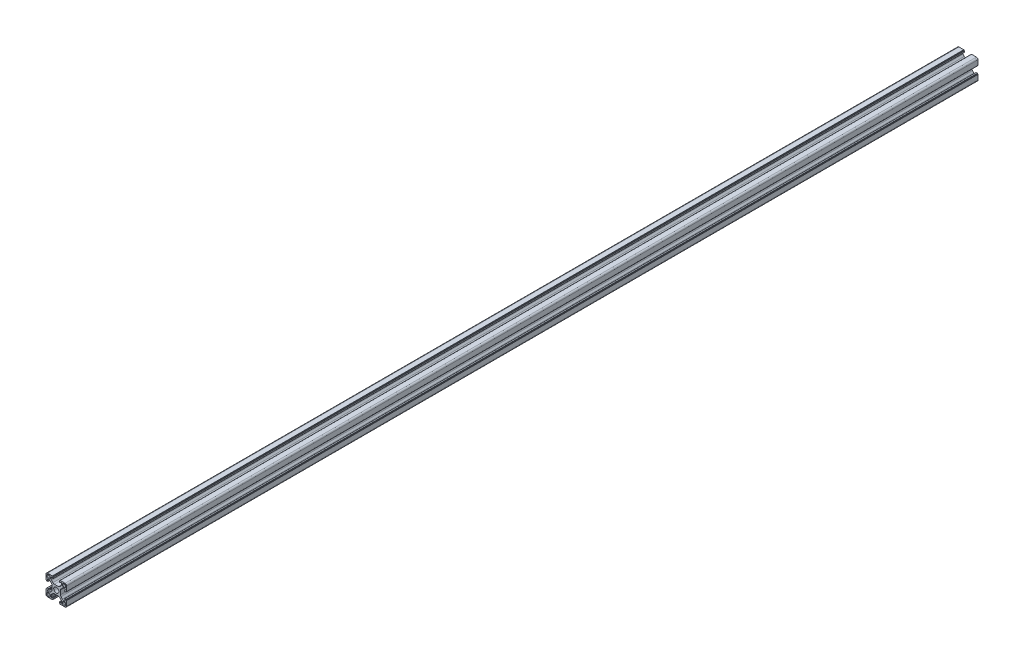
from build123d import *

# Parameters (mm, degrees)
EXTRUDE_1_DEPTH = 885


with BuildPart() as part:
    # Эскиз2 → Бобышка-Вытянуть1 (new body)
    with BuildSketch(Plane.XY):
        with BuildLine():
            Line((0.129852449, 4.683728486), (2.028633118, 4.683728486))
            ThreePointArc((2.028633118, 4.683728486), (2.793999983, 4.835969421), (3.44284668, 5.269514923))
            Line((3.44284668, 5.269514923), (4.744066011, 6.570734254))
            ThreePointArc((4.744066011, 6.570734254), (5.177611514, 7.219580952), (5.329852449, 7.984947817))
            Line((5.329852449, 7.984947817), (5.329852449, 8.883728486))
            ThreePointArc((5.329852449, 8.883728486), (5.183405839, 9.237281876), (4.829852449, 9.383728486))
            Line((4.829852449, 9.383728486), (4.72695923, 9.383728486))
            ThreePointArc((4.72695923, 9.383728486), (4.535617514, 9.345668252), (4.373405839, 9.237281876))
            Line((4.373405839, 9.237281876), (3.893075754, 8.75695179))
            ThreePointArc((3.893075754, 8.75695179), (3.811969916, 8.702758603), (3.716299058, 8.683728486))
            Line((3.716299058, 8.683728486), (3.429852449, 8.683728486))
            ThreePointArc((3.429852449, 8.683728486), (3.253075754, 8.75695179), (3.179852449, 8.933728486))
            Line((3.179852449, 8.933728486), (3.179852449, 10.082799306))
            ThreePointArc((3.179852449, 10.082799306), (3.223786432, 10.188865323), (3.329852449, 10.232799306))
            Line((3.329852449, 10.232799306), (3.829852449, 10.232799306))
            Line((3.829852449, 10.232799306), (3.829852449, 10.533728486))
            ThreePointArc((3.829852449, 10.533728486), (3.873786432, 10.639794503), (3.979852449, 10.683728486))
            Line((3.979852449, 10.683728486), (8.629852449, 10.683728486))
            ThreePointArc((8.629852449, 10.683728486), (9.690512621, 10.244388658), (10.129852449, 9.183728486))
            Line((10.129852449, 9.183728486), (10.129852449, 4.533728486))
            ThreePointArc((10.129852449, 4.533728486), (10.085918466, 4.427662469), (9.979852449, 4.383728486))
            Line((9.979852449, 4.383728486), (9.678923269, 4.383728486))
            Line((9.678923269, 4.383728486), (9.678923269, 3.883728486))
            ThreePointArc((9.678923269, 3.883728486), (9.634989287, 3.777662469), (9.528923269, 3.733728486))
            Line((9.528923269, 3.733728486), (8.379852449, 3.733728486))
            ThreePointArc((8.379852449, 3.733728486), (8.203075754, 3.80695179), (8.129852449, 3.983728486))
            Line((8.129852449, 3.983728486), (8.129852449, 4.270175095))
            ThreePointArc((8.129852449, 4.270175095), (8.148882566, 4.365845953), (8.203075754, 4.44695179))
            Line((8.203075754, 4.44695179), (8.683405839, 4.927281876))
            ThreePointArc((8.683405839, 4.927281876), (8.791792215, 5.089493551), (8.829852449, 5.280835267))
            Line((8.829852449, 5.280835267), (8.829852449, 5.383728486))
            ThreePointArc((8.829852449, 5.383728486), (8.683405839, 5.737281876), (8.329852449, 5.883728486))
            Line((8.329852449, 5.883728486), (7.43107178, 5.883728486))
            ThreePointArc((7.43107178, 5.883728486), (6.665704915, 5.731487551), (6.016858217, 5.297942048))
            Line((6.016858217, 5.297942048), (4.715638886, 3.996722717))
            ThreePointArc((4.715638886, 3.996722717), (4.282093384, 3.34787602), (4.129852449, 2.582509155))
            Line((4.129852449, 2.582509155), (4.129852449, 0.683728486))
            Line((4.129852449, 0.683728486), (4.129852449, -1.215052183))
            ThreePointArc((4.129852449, -1.215052183), (4.282093384, -1.980419048), (4.715638886, -2.629265746))
            Line((4.715638886, -2.629265746), (6.016858217, -3.930485077))
            ThreePointArc((6.016858217, -3.930485077), (6.665704915, -4.364030579), (7.43107178, -4.516271514))
            Line((7.43107178, -4.516271514), (8.329852449, -4.516271514))
            ThreePointArc((8.329852449, -4.516271514), (8.683405839, -4.369824905), (8.829852449, -4.016271514))
            Line((8.829852449, -4.016271514), (8.829852449, -3.913378295))
            ThreePointArc((8.829852449, -3.913378295), (8.791792215, -3.722036579), (8.683405839, -3.559824905))
            Line((8.683405839, -3.559824905), (8.203075754, -3.079494819))
            ThreePointArc((8.203075754, -3.079494819), (8.148882566, -2.998388982), (8.129852449, -2.902718124))
            Line((8.129852449, -2.902718124), (8.129852449, -2.616271514))
            ThreePointArc((8.129852449, -2.616271514), (8.203075754, -2.439494819), (8.379852449, -2.366271514))
            Line((8.379852449, -2.366271514), (9.528923269, -2.366271514))
            ThreePointArc((9.528923269, -2.366271514), (9.634989287, -2.410205497), (9.678923269, -2.516271514))
            Line((9.678923269, -2.516271514), (9.678923269, -3.016271514))
            Line((9.678923269, -3.016271514), (9.979852449, -3.016271514))
            ThreePointArc((9.979852449, -3.016271514), (10.085918466, -3.060205497), (10.129852449, -3.166271514))
            Line((10.129852449, -3.166271514), (10.129852449, -7.816271514))
            ThreePointArc((10.129852449, -7.816271514), (9.690512621, -8.876931686), (8.629852449, -9.316271514))
            Line((8.629852449, -9.316271514), (3.979852449, -9.316271514))
            ThreePointArc((3.979852449, -9.316271514), (3.873786432, -9.272337531), (3.829852449, -9.166271514))
            Line((3.829852449, -9.166271514), (3.829852449, -8.865342335))
            Line((3.829852449, -8.865342335), (3.329852449, -8.865342335))
            ThreePointArc((3.329852449, -8.865342335), (3.223786432, -8.821408352), (3.179852449, -8.715342335))
            Line((3.179852449, -8.715342335), (3.179852449, -7.566271514))
            ThreePointArc((3.179852449, -7.566271514), (3.253075754, -7.389494819), (3.429852449, -7.316271514))
            Line((3.429852449, -7.316271514), (3.716299058, -7.316271514))
            ThreePointArc((3.716299058, -7.316271514), (3.811969916, -7.335301631), (3.893075754, -7.389494819))
            Line((3.893075754, -7.389494819), (4.373405839, -7.869824905))
            ThreePointArc((4.373405839, -7.869824905), (4.535617514, -7.978211281), (4.72695923, -8.016271514))
            Line((4.72695923, -8.016271514), (4.829852449, -8.016271514))
            ThreePointArc((4.829852449, -8.016271514), (5.183405839, -7.869824905), (5.329852449, -7.516271514))
            Line((5.329852449, -7.516271514), (5.329852449, -6.617490845))
            ThreePointArc((5.329852449, -6.617490845), (5.177611514, -5.85212398), (4.744066011, -5.203277283))
            Line((4.744066011, -5.203277283), (3.44284668, -3.902057952))
            ThreePointArc((3.44284668, -3.902057952), (2.793999983, -3.468512449), (2.028633118, -3.316271514))
            Line((2.028633118, -3.316271514), (0.129852449, -3.316271514))
            Line((0.129852449, -3.316271514), (-1.76892822, -3.316271514))
            ThreePointArc((-1.76892822, -3.316271514), (-2.534295085, -3.468512449), (-3.183141783, -3.902057952))
            Line((-3.183141783, -3.902057952), (-4.484361114, -5.203277283))
            ThreePointArc((-4.484361114, -5.203277283), (-4.917906616, -5.85212398), (-5.070147551, -6.617490845))
            Line((-5.070147551, -6.617490845), (-5.070147551, -7.516271514))
            ThreePointArc((-5.070147551, -7.516271514), (-4.923700942, -7.869824905), (-4.570147551, -8.016271514))
            Line((-4.570147551, -8.016271514), (-4.467254332, -8.016271514))
            ThreePointArc((-4.467254332, -8.016271514), (-4.275912616, -7.978211281), (-4.113700942, -7.869824905))
            Line((-4.113700942, -7.869824905), (-3.633370856, -7.389494819))
            ThreePointArc((-3.633370856, -7.389494819), (-3.552265019, -7.335301631), (-3.456594161, -7.316271514))
            Line((-3.456594161, -7.316271514), (-3.170147551, -7.316271514))
            ThreePointArc((-3.170147551, -7.316271514), (-2.993370856, -7.389494819), (-2.920147551, -7.566271514))
            Line((-2.920147551, -7.566271514), (-2.920147551, -8.715342335))
            ThreePointArc((-2.920147551, -8.715342335), (-2.964081534, -8.821408352), (-3.070147551, -8.865342335))
            Line((-3.070147551, -8.865342335), (-3.570147551, -8.865342335))
            Line((-3.570147551, -8.865342335), (-3.570147551, -9.166271514))
            ThreePointArc((-3.570147551, -9.166271514), (-3.614081534, -9.272337531), (-3.720147551, -9.316271514))
            Line((-3.720147551, -9.316271514), (-8.370147551, -9.316271514))
            ThreePointArc((-8.370147551, -9.316271514), (-9.430807723, -8.876931686), (-9.870147551, -7.816271514))
            Line((-9.870147551, -7.816271514), (-9.870147551, -3.166271514))
            ThreePointArc((-9.870147551, -3.166271514), (-9.826213568, -3.060205497), (-9.720147551, -3.016271514))
            Line((-9.720147551, -3.016271514), (-9.419218372, -3.016271514))
            Line((-9.419218372, -3.016271514), (-9.419218372, -2.516271514))
            ThreePointArc((-9.419218372, -2.516271514), (-9.375284389, -2.410205497), (-9.269218372, -2.366271514))
            Line((-9.269218372, -2.366271514), (-8.120147551, -2.366271514))
            ThreePointArc((-8.120147551, -2.366271514), (-7.943370856, -2.439494819), (-7.870147551, -2.616271514))
            Line((-7.870147551, -2.616271514), (-7.870147551, -2.902718124))
            ThreePointArc((-7.870147551, -2.902718124), (-7.889177668, -2.998388982), (-7.943370856, -3.079494819))
            Line((-7.943370856, -3.079494819), (-8.423700942, -3.559824905))
            ThreePointArc((-8.423700942, -3.559824905), (-8.532087317, -3.722036579), (-8.570147551, -3.913378295))
            Line((-8.570147551, -3.913378295), (-8.570147551, -4.016271514))
            ThreePointArc((-8.570147551, -4.016271514), (-8.423700942, -4.369824905), (-8.070147551, -4.516271514))
            Line((-8.070147551, -4.516271514), (-7.171366882, -4.516271514))
            ThreePointArc((-7.171366882, -4.516271514), (-6.406000017, -4.364030579), (-5.75715332, -3.930485077))
            Line((-5.75715332, -3.930485077), (-4.455933989, -2.629265746))
            ThreePointArc((-4.455933989, -2.629265746), (-4.022388486, -1.980419048), (-3.870147551, -1.215052183))
            Line((-3.870147551, -1.215052183), (-3.870147551, 0.683728486))
            Line((-3.870147551, 0.683728486), (-3.870147551, 2.582509155))
            ThreePointArc((-3.870147551, 2.582509155), (-4.022388486, 3.34787602), (-4.455933989, 3.996722717))
            Line((-4.455933989, 3.996722717), (-5.75715332, 5.297942048))
            ThreePointArc((-5.75715332, 5.297942048), (-6.406000017, 5.731487551), (-7.171366882, 5.883728486))
            Line((-7.171366882, 5.883728486), (-8.070147551, 5.883728486))
            ThreePointArc((-8.070147551, 5.883728486), (-8.423700942, 5.737281876), (-8.570147551, 5.383728486))
            Line((-8.570147551, 5.383728486), (-8.570147551, 5.280835267))
            ThreePointArc((-8.570147551, 5.280835267), (-8.532087317, 5.089493551), (-8.423700942, 4.927281876))
            Line((-8.423700942, 4.927281876), (-7.943370856, 4.44695179))
            ThreePointArc((-7.943370856, 4.44695179), (-7.889177668, 4.365845953), (-7.870147551, 4.270175095))
            Line((-7.870147551, 4.270175095), (-7.870147551, 3.983728486))
            ThreePointArc((-7.870147551, 3.983728486), (-7.943370856, 3.80695179), (-8.120147551, 3.733728486))
            Line((-8.120147551, 3.733728486), (-9.269218372, 3.733728486))
            ThreePointArc((-9.269218372, 3.733728486), (-9.375284389, 3.777662469), (-9.419218372, 3.883728486))
            Line((-9.419218372, 3.883728486), (-9.419218372, 4.383728486))
            Line((-9.419218372, 4.383728486), (-9.720147551, 4.383728486))
            ThreePointArc((-9.720147551, 4.383728486), (-9.826213568, 4.427662469), (-9.870147551, 4.533728486))
            Line((-9.870147551, 4.533728486), (-9.870147551, 9.183728486))
            ThreePointArc((-9.870147551, 9.183728486), (-9.430807723, 10.244388658), (-8.370147551, 10.683728486))
            Line((-8.370147551, 10.683728486), (-3.720147551, 10.683728486))
            ThreePointArc((-3.720147551, 10.683728486), (-3.614081534, 10.639794503), (-3.570147551, 10.533728486))
            Line((-3.570147551, 10.533728486), (-3.570147551, 10.232799306))
            Line((-3.570147551, 10.232799306), (-3.070147551, 10.232799306))
            ThreePointArc((-3.070147551, 10.232799306), (-2.964081534, 10.188865323), (-2.920147551, 10.082799306))
            Line((-2.920147551, 10.082799306), (-2.920147551, 8.933728486))
            ThreePointArc((-2.920147551, 8.933728486), (-2.993370856, 8.75695179), (-3.170147551, 8.683728486))
            Line((-3.170147551, 8.683728486), (-3.456594161, 8.683728486))
            ThreePointArc((-3.456594161, 8.683728486), (-3.552265019, 8.702758603), (-3.633370856, 8.75695179))
            Line((-3.633370856, 8.75695179), (-4.113700942, 9.237281876))
            ThreePointArc((-4.113700942, 9.237281876), (-4.275912616, 9.345668252), (-4.467254332, 9.383728486))
            Line((-4.467254332, 9.383728486), (-4.570147551, 9.383728486))
            ThreePointArc((-4.570147551, 9.383728486), (-4.923700942, 9.237281876), (-5.070147551, 8.883728486))
            Line((-5.070147551, 8.883728486), (-5.070147551, 7.984947817))
            ThreePointArc((-5.070147551, 7.984947817), (-4.917906616, 7.219580952), (-4.484361114, 6.570734254))
            Line((-4.484361114, 6.570734254), (-3.183141783, 5.269514923))
            ThreePointArc((-3.183141783, 5.269514923), (-2.534295085, 4.835969421), (-1.76892822, 4.683728486))
            Line((-1.76892822, 4.683728486), (0.129852449, 4.683728486))
        make_face()
        with BuildLine():
            Line((7.029852449, 6.783728486), (8.429852449, 6.783728486))
            ThreePointArc((8.429852449, 6.783728486), (8.995537874, 7.018043061), (9.229852449, 7.583728486))
            Line((9.229852449, 7.583728486), (9.229852449, 8.983728486))
            ThreePointArc((9.229852449, 8.983728486), (8.995537874, 9.549413911), (8.429852449, 9.783728486))
            Line((8.429852449, 9.783728486), (7.029852449, 9.783728486))
            ThreePointArc((7.029852449, 9.783728486), (6.464167024, 9.549413911), (6.229852449, 8.983728486))
            Line((6.229852449, 8.983728486), (6.229852449, 7.583728486))
            ThreePointArc((6.229852449, 7.583728486), (6.464167024, 7.018043061), (7.029852449, 6.783728486))
        make_face(mode=Mode.SUBTRACT)
        with BuildLine():
            Line((6.229852449, -6.216271514), (6.229852449, -7.616271514))
            ThreePointArc((6.229852449, -7.616271514), (6.464167024, -8.181956939), (7.029852449, -8.416271514))
            Line((7.029852449, -8.416271514), (8.429852449, -8.416271514))
            ThreePointArc((8.429852449, -8.416271514), (8.995537874, -8.181956939), (9.229852449, -7.616271514))
            Line((9.229852449, -7.616271514), (9.229852449, -6.216271514))
            ThreePointArc((9.229852449, -6.216271514), (8.995537874, -5.650586089), (8.429852449, -5.416271514))
            Line((8.429852449, -5.416271514), (7.029852449, -5.416271514))
            ThreePointArc((7.029852449, -5.416271514), (6.464167024, -5.650586089), (6.229852449, -6.216271514))
        make_face(mode=Mode.SUBTRACT)
        with BuildLine():
            Line((-6.770147551, -5.416271514), (-8.170147551, -5.416271514))
            ThreePointArc((-8.170147551, -5.416271514), (-8.735832976, -5.650586089), (-8.970147551, -6.216271514))
            Line((-8.970147551, -6.216271514), (-8.970147551, -7.616271514))
            ThreePointArc((-8.970147551, -7.616271514), (-8.735832976, -8.181956939), (-8.170147551, -8.416271514))
            Line((-8.170147551, -8.416271514), (-6.770147551, -8.416271514))
            ThreePointArc((-6.770147551, -8.416271514), (-6.204462126, -8.181956939), (-5.970147551, -7.616271514))
            Line((-5.970147551, -7.616271514), (-5.970147551, -6.216271514))
            ThreePointArc((-5.970147551, -6.216271514), (-6.204462126, -5.650586089), (-6.770147551, -5.416271514))
        make_face(mode=Mode.SUBTRACT)
        with BuildLine():
            Line((-5.970147551, 7.583728486), (-5.970147551, 8.983728486))
            ThreePointArc((-5.970147551, 8.983728486), (-6.204462126, 9.549413911), (-6.770147551, 9.783728486))
            Line((-6.770147551, 9.783728486), (-8.170147551, 9.783728486))
            ThreePointArc((-8.170147551, 9.783728486), (-8.735832976, 9.549413911), (-8.970147551, 8.983728486))
            Line((-8.970147551, 8.983728486), (-8.970147551, 7.583728486))
            ThreePointArc((-8.970147551, 7.583728486), (-8.735832976, 7.018043061), (-8.170147551, 6.783728486))
            Line((-8.170147551, 6.783728486), (-6.770147551, 6.783728486))
            ThreePointArc((-6.770147551, 6.783728486), (-6.204462126, 7.018043061), (-5.970147551, 7.583728486))
        make_face(mode=Mode.SUBTRACT)
        with BuildLine():
            ThreePointArc((2.629852449, 0.683728486), (1.897619402, 2.451495439), (0.129852449, 3.183728486))
            ThreePointArc((0.129852449, 3.183728486), (-1.637914504, 2.451495439), (-2.370147551, 0.683728486))
            ThreePointArc((-2.370147551, 0.683728486), (-1.637914504, -1.084038467), (0.129852449, -1.816271514))
            ThreePointArc((0.129852449, -1.816271514), (1.897619402, -1.084038467), (2.629852449, 0.683728486))
        make_face(mode=Mode.SUBTRACT)
    extrude(amount=EXTRUDE_1_DEPTH)


solid = part.part
